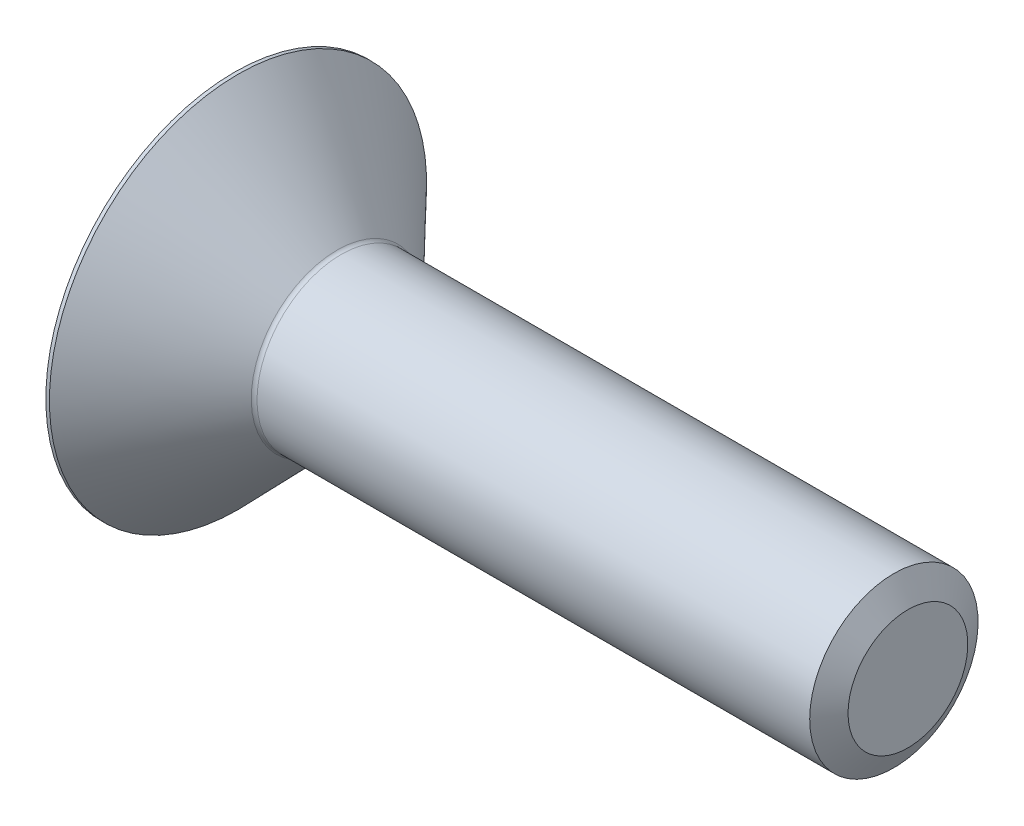
from build123d import *

# Parameters (mm, degrees)
CUT_EXTRUDE_1_DEPTH = 1.96


with BuildPart() as part:
    # 草图1 → 旋转1 (revolve)
    with BuildSketch(Plane.XY):
        with BuildLine():
            Line((0, 1.5), (-10.097552518, 1.5))
            ThreePointArc((-10.097552518, 1.5), (-10.136625631, 1.507949515), (-10.169486498, 1.530534163))
            Line((-10.169486498, 1.530534163), (-11.936181121, 3.36))
            Line((-11.936181121, 3.36), (-12, 3.36))
            Line((-12, 3.36), (-12, 0))
            Line((-12, 0), (0, 0))
            Line((0, 0), (0, 1.5))
        make_face()
    revolve(axis=Axis((0, 0, 0), (-1, 0, 0)))

    # 草图2 → 切除-拉伸1 (cut)
    with BuildSketch(Plane.ZY.offset(12)):
        Polygon((0, 1.154700538), (-1, 0.577350269), (-1, -0.577350269), (0, -1.154700538), (1, -0.577350269), (1, 0.577350269), align=None)
    extrude(amount=-CUT_EXTRUDE_1_DEPTH, mode=Mode.SUBTRACT)

    # 草图6 → 旋转2 (revolve)
    with BuildSketch(Plane.XY):
        Polygon((-10.9, 1.154700538), (-10.233333333, 0), (-9.74, 0), (-9.74, 1.154700538), align=None)
    revolve(axis=Axis((-12, 0, 0), (1, 0, 0)))

    # 草图7 → 切除-旋转2 (revolve, cut)
    with BuildSketch(Plane.XY):
        Polygon((-12, 1.154700538), (-12, 0), (-11.67, 0), align=None)
    revolve(axis=Axis((-12, 0, 0), (1, 0, 0)), mode=Mode.SUBTRACT)

    # 草图4 → 切除-旋转1 (revolve, cut)
    with BuildSketch(Plane.XY):
        Polygon((-0.25, 1.5), (0, 1.066987298), (0.25, 1.5), align=None)
    revolve(axis=Axis((-0.25, 0, 0), (1, 0, 0)), mode=Mode.SUBTRACT)


solid = part.part
